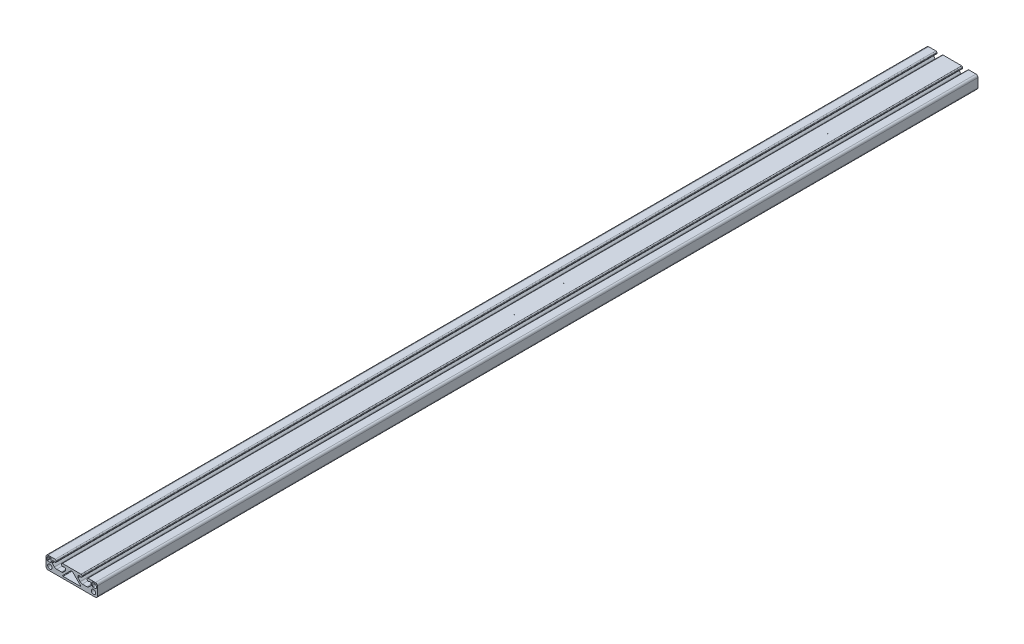
from build123d import *

# Parameters (mm, degrees)
SKETCH1_R          = 3.4
SKETCH1_R_2        = 3.400000006
EXTRUDE1_DEPTH     = 1371.6
SKETCH2_R          = 2.065
CUT_EXTRUDE1_DEPTH = 1373.328945544
SKETCH8_R          = 2.065
CUT_EXTRUDE2_DEPTH = 10


with BuildPart() as part:
    # Sketch1 → Extrude1 (new body)
    with BuildSketch(Plane.XY):
        with BuildLine():
            Line((-36.828217803, 10), (-25.761678346, 10))
            ThreePointArc((-25.761678346, 10), (-24.566343162, 9.581217839), (-24.06, 8.420260776))
            Line((-24.06, 8.420260776), (-24.06, 7.505975062))
            ThreePointArc((-24.06, 7.505975062), (-24.567063435, 6.348506245), (-25.761678346, 5.936507937))
            Line((-25.761678346, 5.936507937), (-26.89856374, 5.936507937))
            Line((-26.89856374, 5.936507937), (-26.89856374, 6.405354551))
            Line((-26.89856374, 6.405354551), (-29.01515873, 6.405354551))
            ThreePointArc((-29.01515873, 6.405354551), (-29.913072103, 6.033426654), (-30.285, 5.135513281))
            Line((-30.285, 5.135513281), (-30.285, 2.878955078))
            ThreePointArc((-30.285, 2.878955078), (-30.217342047, 2.538803338), (-30.024667785, 2.250433031))
            Line((-30.024667785, 2.250433031), (-26.865511635, -0.908897163))
            ThreePointArc((-26.865511635, -0.908897163), (-25.324726136, -1.938463161), (-23.50722312, -2.3))
            Line((-23.50722312, -2.3), (-16.234679932, -2.3))
            ThreePointArc((-16.234679932, -2.3), (-14.417176915, -1.938463161), (-12.876391416, -0.908897163))
            Line((-12.876391416, -0.908897163), (-9.975332215, 1.992321863))
            ThreePointArc((-9.975332215, 1.992321863), (-9.782657953, 2.28069217), (-9.715, 2.620843911))
            Line((-9.715, 2.620843911), (-9.715, 5.135513281))
            ThreePointArc((-9.715, 5.135513281), (-10.086927897, 6.033426654), (-10.98484127, 6.405354551))
            Line((-10.98484127, 6.405354551), (-13.228511431, 6.405354551))
            Line((-13.228511431, 6.405354551), (-13.228511431, 5.936507937))
            Line((-13.228511431, 5.936507937), (-14.365396825, 5.936507937))
            ThreePointArc((-14.365396825, 5.936507937), (-15.478809408, 6.397698529), (-15.94, 7.511111111))
            Line((-15.94, 7.511111111), (-15.94, 8.425396825))
            ThreePointArc((-15.94, 8.425396825), (-15.478809408, 9.538809408), (-14.365396825, 10))
            Line((-14.365396825, 10), (-7.044126982, 10))
            Line((-7.044126982, 10), (14.552471996, 10))
            ThreePointArc((14.552471996, 10), (15.546813416, 9.477564883), (15.94, 8.425396825))
            Line((15.94, 8.425396825), (15.94, 7.511111111))
            ThreePointArc((15.94, 7.511111111), (15.478809408, 6.397698529), (14.365396825, 5.936507937))
            Line((14.365396825, 5.936507937), (13.228511431, 5.936507937))
            Line((13.228511431, 5.936507937), (13.228511431, 6.660633301))
            Line((13.228511431, 6.660633301), (10.98484127, 6.660633301))
            ThreePointArc((10.98484127, 6.660633301), (10.086927897, 6.288705404), (9.715, 5.390792031))
            Line((9.715, 5.390792031), (9.715, 3.134233829))
            ThreePointArc((9.715, 3.134233829), (9.782657953, 2.794082088), (9.975332215, 2.505711781))
            Line((9.975332215, 2.505711781), (13.134488365, -0.653618412))
            ThreePointArc((13.134488365, -0.653618412), (14.64473832, -1.821319739), (16.49277688, -2.3))
            Line((16.49277688, -2.3), (23.50722312, -2.3))
            ThreePointArc((23.50722312, -2.3), (25.324726136, -1.938463161), (26.865511635, -0.908897163))
            Line((26.865511635, -0.908897163), (30.024667785, 2.250433031))
            ThreePointArc((30.024667785, 2.250433031), (30.278278636, 2.655971567), (30.285, 3.134233829))
            Line((30.285, 3.134233829), (30.285, 5.390792031))
            ThreePointArc((30.285, 5.390792031), (29.913072103, 6.288705404), (29.01515873, 6.660633301))
            Line((29.01515873, 6.660633301), (26.771488569, 6.660633301))
            Line((26.771488569, 6.660633301), (26.771488569, 5.936507937))
            Line((26.771488569, 5.936507937), (25.634603175, 5.936507937))
            ThreePointArc((25.634603175, 5.936507937), (24.521190592, 6.397698529), (24.06, 7.511111111))
            Line((24.06, 7.511111111), (24.06, 8.425396825))
            ThreePointArc((24.06, 8.425396825), (24.453186584, 9.477564883), (25.447528004, 10))
            Line((25.447528004, 10), (33.075833554, 10))
            Line((33.075833554, 10), (36.885357363, 10))
            ThreePointArc((36.885357363, 10), (39.090491138, 9.050251023), (40, 6.828217785))
            Line((40, 6.828217785), (40, -6.828217785))
            ThreePointArc((40, -6.828217785), (39.069183486, -9.071177839), (36.825396825, -10))
            Line((36.825396825, -10), (-36.828217803, -10))
            ThreePointArc((-36.828217803, -10), (-39.071006503, -9.071006503), (-40, -6.828217803))
            Line((-40, -6.828217803), (-40, 6.828217803))
            ThreePointArc((-40, 6.828217803), (-39.071006503, 9.071006503), (-36.828217803, 10))
        make_face()
        with Locations((-34.004773868, -4)):
            Circle(SKETCH1_R, mode=Mode.SUBTRACT)
        with Locations(Location((34.004773868, -4, 0), (0, 0, 180))):
            Circle(SKETCH1_R_2, mode=Mode.SUBTRACT)
        with BuildLine():
            Line((-38.35, 2.595292927), (-38.35, 5.557055178))
            ThreePointArc((-38.35, 5.557055178), (-37.509428882, 7.554544736), (-35.493548116, 8.35))
            Line((-35.493548116, 8.35), (-32.569919859, 8.35))
            ThreePointArc((-32.569919859, 8.35), (-32.120963721, 8.164036279), (-31.935, 7.715080141))
            Line((-31.935, 7.715080141), (-31.935, 3.230213422))
            ThreePointArc((-31.935, 3.230213422), (-32.306927856, 2.332300148), (-33.20484113, 1.960372292))
            Line((-33.20484113, 1.960372292), (-37.715079365, 1.960372292))
            ThreePointArc((-37.715079365, 1.960372292), (-38.164036052, 2.14633624), (-38.35, 2.595292927))
        make_face(mode=Mode.SUBTRACT)
        with BuildLine():
            Line((13.450195503, -6.954394873), (-13.450195503, -6.954394873))
            ThreePointArc((-13.450195503, -6.954394873), (-14.036762187, -6.562412722), (-13.89908728, -5.870490687))
            Line((-13.89908728, -5.870490687), (-1.257767926, 6.769315833))
            ThreePointArc((-1.257767926, 6.769315833), (-1.051776589, 6.906937009), (-0.808800063, 6.955252915))
            Line((-0.808800063, 6.955252915), (0, 6.955204454))
            Line((0, 6.955204454), (0.808800063, 6.955252915))
            ThreePointArc((0.808800063, 6.955252915), (1.051776589, 6.906937009), (1.257767926, 6.769315833))
            Line((1.257767926, 6.769315833), (13.89908728, -5.870490687))
            ThreePointArc((13.89908728, -5.870490687), (14.036762187, -6.562412722), (13.450195503, -6.954394873))
        make_face(mode=Mode.SUBTRACT)
        with BuildLine():
            Line((35.554894965, 8.35), (32.563967874, 8.35))
            ThreePointArc((32.563967874, 8.35), (32.121226634, 8.164362109), (31.935, 7.721868186))
            Line((31.935, 7.721868186), (31.935, 3.245873842))
            ThreePointArc((31.935, 3.245873842), (32.306927897, 2.347960469), (33.20484127, 1.976032573))
            Line((33.20484127, 1.976032573), (37.680832198, 1.976032573))
            ThreePointArc((37.680832198, 1.976032573), (38.126707117, 2.122693703), (38.35, 2.535554718))
            Line((38.35, 2.535554718), (38.35, 5.496770698))
            ThreePointArc((38.35, 5.496770698), (37.552616332, 7.511327921), (35.554894965, 8.35))
        make_face(mode=Mode.SUBTRACT)
    extrude(amount=-EXTRUDE1_DEPTH)

    # Sketch2 → Cut-Extrude1 (cut, through all)
    with BuildSketch(Plane.XZ.offset(10)):
        with Locations((-19.935, -1351.6)):
            Circle(SKETCH2_R)
        with Locations((-19.935, -1301.6)):
            Circle(SKETCH2_R)
        with Locations((19.935, -1301.6)):
            Circle(SKETCH2_R)
        with Locations((19.935, -1351.6)):
            Circle(SKETCH2_R)
    extrude(amount=-CUT_EXTRUDE1_DEPTH, mode=Mode.SUBTRACT)

    # Sketch8 → Cut-Extrude2 (cut)
    with BuildSketch(Plane.XZ.offset(10)):
        with Locations((-19.935, -82.4)):
            Circle(SKETCH8_R)
        with Locations((-19.935, -32.4)):
            Circle(SKETCH8_R)
        with Locations((19.935, -32.4)):
            Circle(SKETCH8_R)
        with Locations((19.935, -82.4)):
            Circle(SKETCH8_R)
    extrude(amount=-CUT_EXTRUDE2_DEPTH, mode=Mode.SUBTRACT)


solid = part.part
